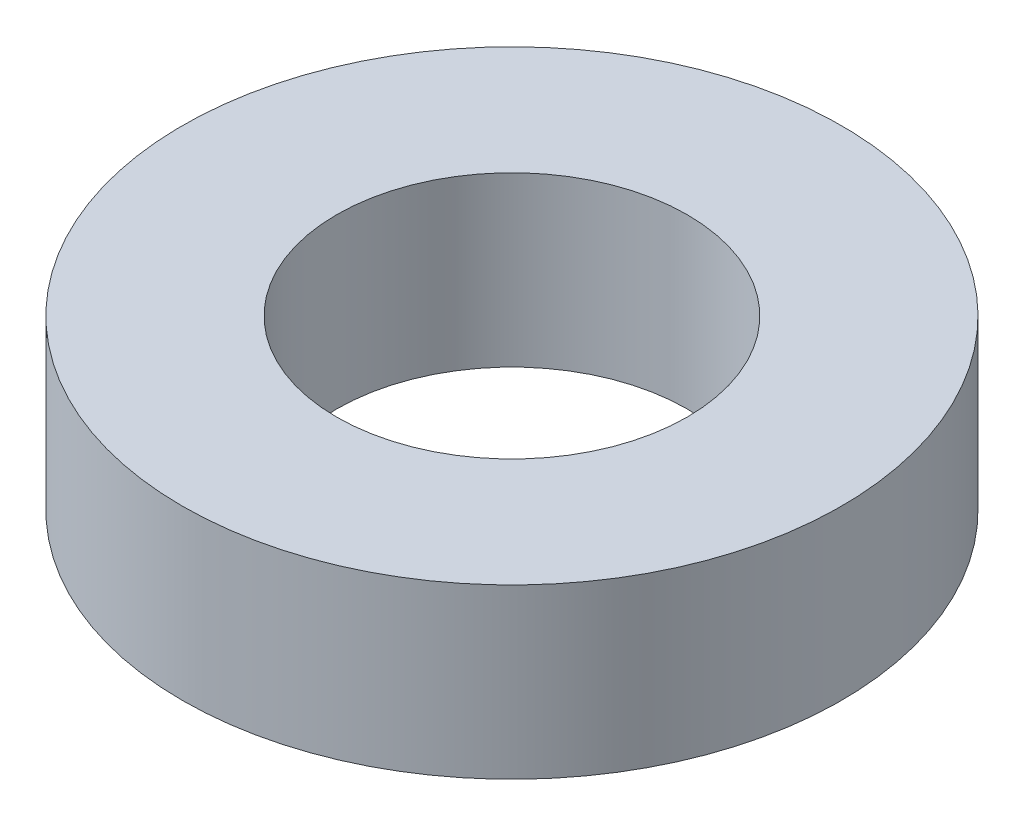
from build123d import *

# Parameters (mm, degrees)
SKETCH_1_R      = 23.5
SKETCH_1_R_2    = 12.5
EXTRUDE_1_DEPTH = 12


with BuildPart() as part:
    # 草图1 → 凸台-拉伸1 (new body)
    with BuildSketch(Plane(origin=(0, 0, 0), x_dir=(1, 0, 0), z_dir=(0, 1, 0))):
        with Locations(Location((0, 0, 0), (0, 0, 270))):
            Circle(SKETCH_1_R)
        with Locations(Location((0, 0, 0), (0, 0, 270))):
            Circle(SKETCH_1_R_2, mode=Mode.SUBTRACT)
    extrude(amount=EXTRUDE_1_DEPTH)


solid = part.part
